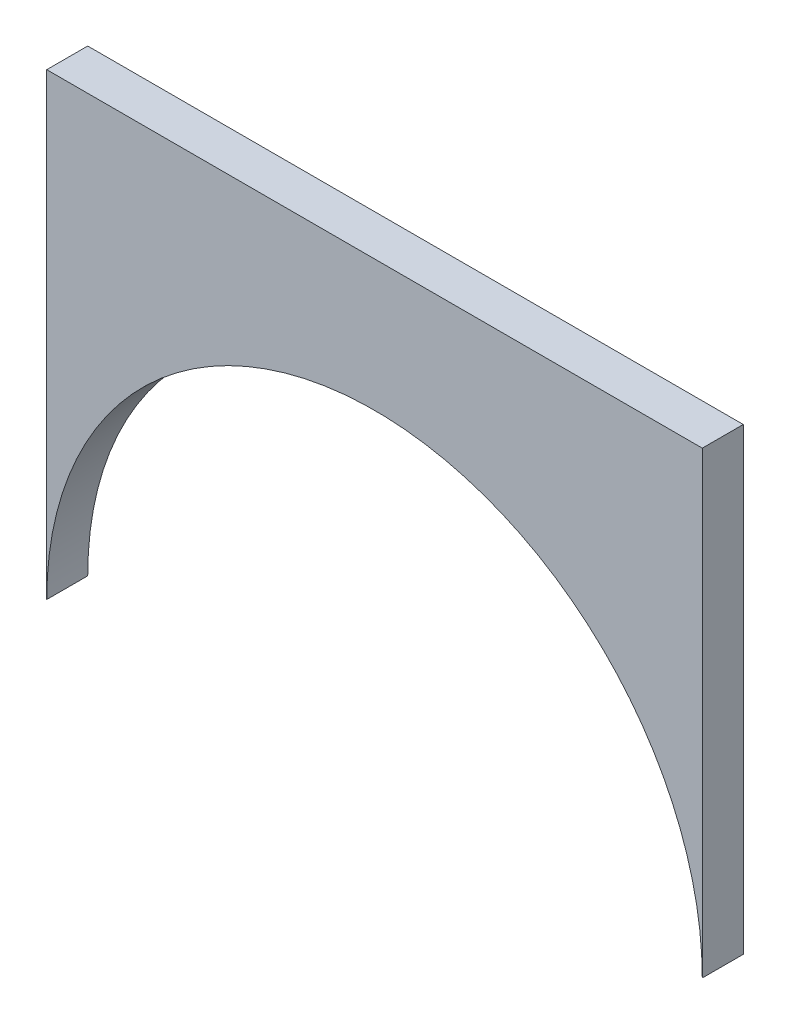
from build123d import *

# Parameters (mm, degrees)
EXTRUDE_1_DEPTH = 2.5


with BuildPart() as part:
    # 스케치1 → 보스-돌출1 (new body)
    with BuildSketch(Plane.XY):
        with BuildLine():
            Line((-20, 0), (-20, 28))
            Line((-20, 28), (20, 28))
            Line((20, 28), (20, 0))
            ThreePointArc((20, 0), (0, 20), (-20, 0))
        make_face()
    extrude(amount=EXTRUDE_1_DEPTH)


solid = part.part
